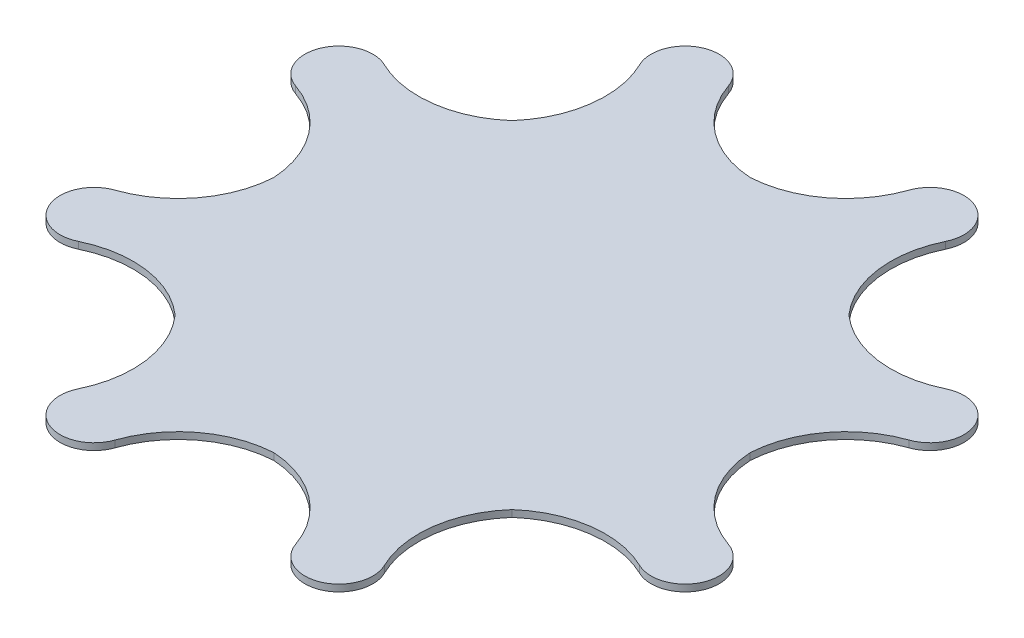
from build123d import *

# Parameters (mm, degrees)
BOSS_EXTRUDE1_DEPTH = 2
CIRPATTERN1_COUNT   = 8


with BuildPart() as part:
    # Sketch1 → Boss-Extrude1 (new body)
    with BuildSketch(Plane(origin=(0, 0, 0), x_dir=(1, 0, 0), z_dir=(0, 1, 0))):
        with BuildLine():
            Line((28.994949366, -70), (70, -28.994949366))
            Line((70, -28.994949366), (70, 28.994949366))
            Line((70, 28.994949366), (28.994949366, 70))
            Line((28.994949366, 70), (1.798096452, 70))
            ThreePointArc((1.798096452, 70), (-15.601802765, 75.561434018), (-26.550475887, 90.183766184))
            ThreePointArc((-26.550475887, 90.183766184), (-39.826834324, 96.150483571), (-44.995531078, 82.543574165))
            ThreePointArc((-44.995531078, 82.543574165), (-42.397861857, 64.462142924), (-50.768920878, 48.226028488))
            Line((-50.768920878, 48.226028488), (-70, 28.994949366))
            Line((-70, 28.994949366), (-70, -28.994949366))
            Line((-70, -28.994949366), (-28.994949366, -70))
            Line((-28.994949366, -70), (28.994949366, -70))
        make_face()
    boss_extrude1 = extrude(amount=BOSS_EXTRUDE1_DEPTH)

    # CirPattern1: Boss-Extrude1 ×8 about axis
    cirpattern1_axis = Axis((0, 2.1, 0), (0, -1, 0))
    for i in range(1, CIRPATTERN1_COUNT):
        add(boss_extrude1.rotate(cirpattern1_axis, i * 360 / CIRPATTERN1_COUNT))


solid = part.part
